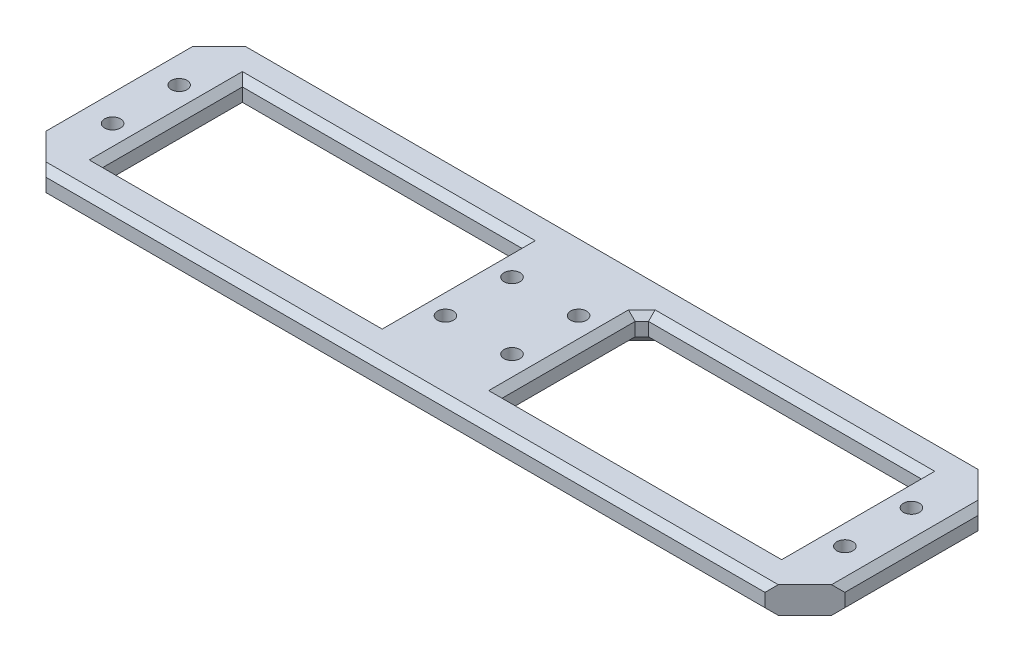
from build123d import *

# Parameters (mm, degrees)
SKETCH1_W           = 120
SKETCH1_H           = 32
BOSS_EXTRUDE1_DEPTH = 4
SKETCH2_R           = 1.2
SKETCH2_W           = 42
SKETCH2_H           = 21
CUT_EXTRUDE1_DEPTH  = 4
CHAMFER1_SIZE       = 1
CUT_EXTRUDE2_DEPTH  = 10


with BuildPart() as part:
    # Sketch1 → Boss-Extrude1 (new body)
    with BuildSketch(Plane(origin=(0, 0, 0), x_dir=(1, 0, 0), z_dir=(0, 1, 0))):
        Rectangle(SKETCH1_W, SKETCH1_H)
    extrude(amount=BOSS_EXTRUDE1_DEPTH)

    # Sketch2 → Cut-Extrude1 (cut)
    with BuildSketch(Plane(origin=(0, 4, 0), x_dir=(1, 0, 0), z_dir=(0, 1, 0))):
        with Locations(Location((55, 5, 0), (0, 0, 270))):
            Circle(SKETCH2_R)
        with Locations(Location((55, -5, 0), (0, 0, 270))):
            Circle(SKETCH2_R)
        with Locations(Location((5, 5, 0), (0, 0, 270))):
            Circle(SKETCH2_R)
        with Locations(Location((5, -5, 0), (0, 0, 270))):
            Circle(SKETCH2_R)
        with Locations((30, 0)):
            Rectangle(SKETCH2_W, SKETCH2_H)
    cut_extrude1 = extrude(amount=-CUT_EXTRUDE1_DEPTH, mode=Mode.SUBTRACT)

    # Mirror1: Cut-Extrude1 across plane
    add(cut_extrude1.mirror(Plane(origin=(0, 0, 0), x_dir=(0, 0, 1), z_dir=(1, 0, 0))), mode=Mode.SUBTRACT)

    # Chamfer1
    chamfer1_edges = [part.edges().sort_by_distance(p)[0] for p in [
        (-60, 4, 0),
        (0, 4, 16),
        (9, 0, 0),
        (30, 0, -10.5),
        (9, 2, -10.5),
        (51, 0, 0),
        (30, 0, 10.5),
        (9, 4, 0),
        (30, 4, 10.5),
        (51, 4, 0),
        (30, 4, -10.5),
        (60, 4, 0),
        (0, 0, 16),
        (0, 0, -16),
        (60, 0, 0),
        (-9, 4, 0),
        (-30, 4, 10.5),
        (-51, 4, 0),
        (-30, 4, -10.5),
        (-9, 0, 0),
        (-30, 0, 10.5),
        (-51, 0, 0),
        (-30, 0, -10.5),
        (0, 4, -16),
        (60, 2, 16),
        (-60, 2, 16),
        (-60, 2, -16),
        (60, 2, -16),
    ]]
    chamfer(chamfer1_edges, length=CHAMFER1_SIZE)

    # Sketch3 → Cut-Extrude2 (cut)
    with BuildSketch(Plane.XZ):
        Polygon((-60, 10), (-54, 16), (-63.164716505, 19.318756061), align=None)
        Polygon((-60, -10), (-54, -16), (-62.553854867, -17.935195974), align=None)
    cut_extrude2 = extrude(amount=-CUT_EXTRUDE2_DEPTH, mode=Mode.SUBTRACT)

    # Mirror2: Cut-Extrude2 across plane
    add(cut_extrude2.mirror(Plane(origin=(0, 0, 0), x_dir=(0, 0, 1), z_dir=(1, 0, 0))), mode=Mode.SUBTRACT)


solid = part.part
